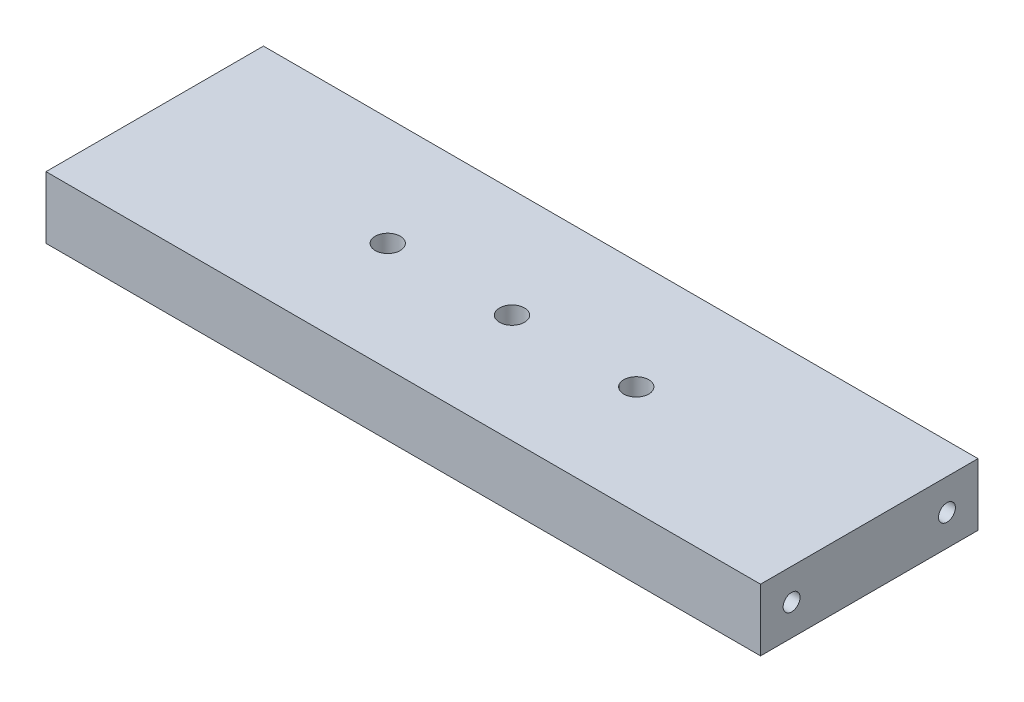
from build123d import *

# Parameters (mm, degrees)
SKETCH2_W                      = 146.05
SKETCH2_H                      = 44.45
BOSS_EXTRUDE1_DEPTH            = 12.7
F_1_4_20_TAPPED_HOLE1_D        = 5.1054
F_8_32_TAPPED_HOLE1_AT_2_COUNT = 2
F_8_32_TAPPED_HOLE1_AT_2_PITCH = 31.75


with BuildPart() as part:
    # Sketch2 → Boss-Extrude1 (new body)
    with BuildSketch(Plane(origin=(0, 0, 0), x_dir=(1, 0, 0), z_dir=(0, 1, 0))):
        Rectangle(SKETCH2_W, SKETCH2_H)
    extrude(amount=BOSS_EXTRUDE1_DEPTH)

    # 1/4-20 Tapped Hole1 (through all)
    with Locations(Plane(origin=(0, 0, 0), x_dir=(-1, 0, 0), z_dir=(0, -1, 0))):
        with Locations((0, 0), (-25.4, 0), (25.4, 0)):
            Hole(F_1_4_20_TAPPED_HOLE1_D / 2)

    # Sketch7 → #8-32 Tapped Hole1 (revolve, cut)
    with BuildSketch(Plane(origin=(-73.025, 6.35, -15.875), x_dir=(0, 0, 1), z_dir=(0, 1, 0))):
        Polygon((0, 0), (0, 7.387806461), (1.7272, 6.35), (1.7272, 0), align=None)
    f_8_32_tapped_hole1 = revolve(axis=Axis((-79.375, 6.35, -15.875), (1, 0, 0)), mode=Mode.SUBTRACT)

    # #8-32 Tapped Hole1 at 2: #8-32 Tapped Hole1 ×2
    with Locations(*[(0, 0, i * F_8_32_TAPPED_HOLE1_AT_2_PITCH) for i in range(1, F_8_32_TAPPED_HOLE1_AT_2_COUNT)]):
        add(f_8_32_tapped_hole1, mode=Mode.SUBTRACT)

    # Mirror1: #8-32 Tapped Hole1 across plane
    add(f_8_32_tapped_hole1.mirror(Plane(origin=(0, 0, 0), x_dir=(0, 0, 1), z_dir=(1, 0, 0))), mode=Mode.SUBTRACT)

    # Mirror1 copy 1 sketch → Mirror1 copy 1 (revolve, cut)
    with BuildSketch(Plane(origin=(73.025, 6.35, 15.875), x_dir=(0, 0, 1), z_dir=(0, 1, 0))):
        Polygon((0, 0), (0, -7.387806461), (1.7272, -6.35), (1.7272, 0), align=None)
    revolve(axis=Axis((79.375, 6.35, 15.875), (1, 0, 0)), mode=Mode.SUBTRACT)


solid = part.part
